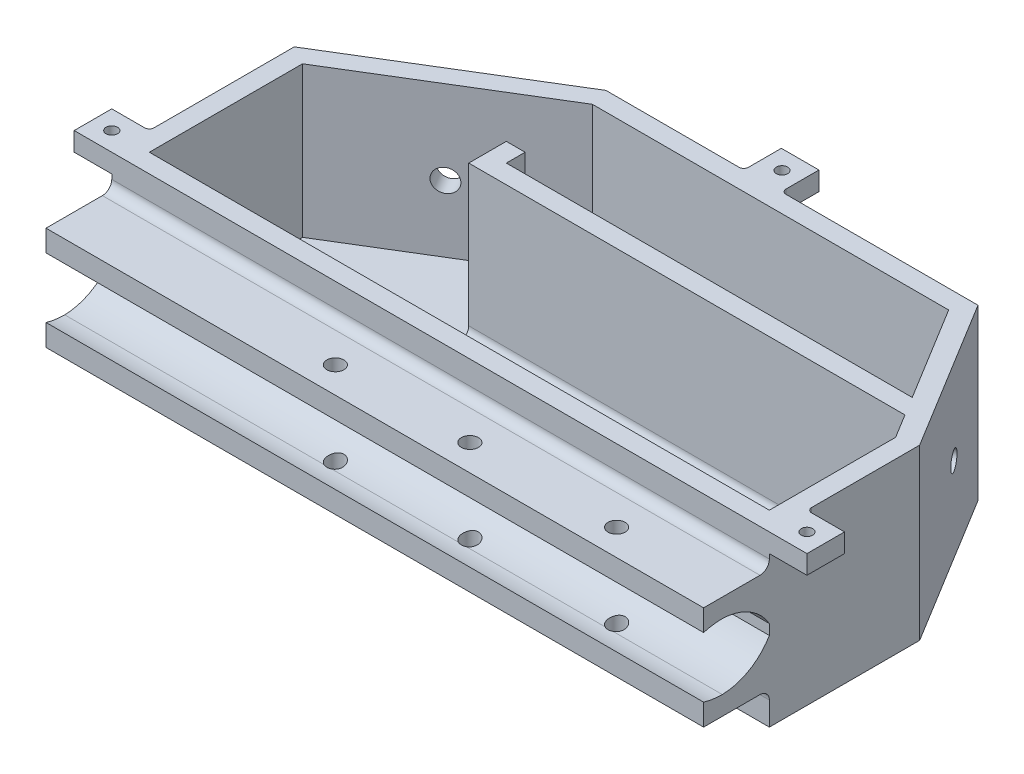
from build123d import *

# Parameters (mm, degrees)
SKETCH1_W            = 350
SKETCH1_H            = 160
SKETCH1_W_2          = 330
SKETCH1_H_2          = 140
BOSS_EXTRUDE1_DEPTH  = 80
SKETCH2_W            = 350
SKETCH2_H            = 160
BOSS_EXTRUDE2_DEPTH  = 10
SKETCH3_W            = 240
SKETCH3_H            = 10
BOSS_EXTRUDE3_DEPTH  = 80
SKETCH4_R            = 8.25
CUT_EXTRUDE1_DEPTH   = 10
SKETCH5_W            = 10
SKETCH5_H            = 80
BOSS_EXTRUDE4_DEPTH  = 10
SKETCH6_W            = 35
SKETCH6_H            = 55
BOSS_EXTRUDE5_DEPTH  = 350
CUT_EXTRUDE2_DEPTH   = 377.994694923
SKETCH8_R            = 4.55
CUT_EXTRUDE3_DEPTH   = 222.599300704
SKETCH9_W            = 20
SKETCH9_H            = 20
SKETCH9_R            = 3.05
BOSS_EXTRUDE7_DEPTH  = 10
FILLET1_R            = 5
CUT_EXTRUDE5_DEPTH   = 244.618554386
SKETCH13_W           = 120.654432285
SKETCH13_H           = 90
BOSS_EXTRUDE8_DEPTH  = 10
CUT_EXTRUDE8_DEPTH   = 244.618554386
SKETCH15_W           = 93.792566681
SKETCH15_H           = 90
BOSS_EXTRUDE9_DEPTH  = 10
SKETCH16_W           = 20
SKETCH16_H           = 20
SKETCH16_R           = 3.05
BOSS_EXTRUDE10_DEPTH = 10
SKETCH17_R           = 5
CUT_EXTRUDE9_DEPTH   = 10
SKETCH18_R           = 6
CUT_EXTRUDE10_DEPTH  = 10
FILLET2_R            = 2.5


with BuildPart() as part:
    # Sketch1 → Boss-Extrude1 (new body)
    with BuildSketch(Plane(origin=(0, 0, 0), x_dir=(1, 0, 0), z_dir=(0, 1, 0))):
        Rectangle(SKETCH1_W, SKETCH1_H)
        Rectangle(SKETCH1_W_2, SKETCH1_H_2, mode=Mode.SUBTRACT)
    extrude(amount=BOSS_EXTRUDE1_DEPTH)

    # Sketch2 → Boss-Extrude2 (add)
    with BuildSketch(Plane.XZ):
        Rectangle(SKETCH2_W, SKETCH2_H)
    extrude(amount=BOSS_EXTRUDE2_DEPTH)

    # Sketch3 → Boss-Extrude3 (add)
    with BuildSketch(Plane(origin=(0, 0, 0), x_dir=(1, 0, 0), z_dir=(0, 1, 0))):
        with Locations((45, 15)):
            Rectangle(SKETCH3_W, SKETCH3_H)
    extrude(amount=BOSS_EXTRUDE3_DEPTH)

    # Sketch4 → Cut-Extrude1 (cut)
    with BuildSketch(Plane.XZ.offset(10)):
        with Locations(Location((115, -45, 0), (0, 0, 270))):
            Circle(SKETCH4_R)
    extrude(amount=-CUT_EXTRUDE1_DEPTH, mode=Mode.SUBTRACT)

    # Sketch5 → Boss-Extrude4 (add)
    with BuildSketch(Plane(origin=(0, 0, -20), x_dir=(-1, 0, 0), z_dir=(0, 0, -1))):
        with Locations((70, 40)):
            Rectangle(SKETCH5_W, SKETCH5_H)
    extrude(amount=BOSS_EXTRUDE4_DEPTH)

    # Sketch6 → Boss-Extrude5 (add)
    with BuildSketch(Plane.ZY.offset(175)):
        with Locations((97.5, 35)):
            Rectangle(SKETCH6_W, SKETCH6_H)
    extrude(amount=-BOSS_EXTRUDE5_DEPTH)

    # Sketch7 → Cut-Extrude2 (cut, through all)
    with BuildSketch(Plane.ZY.offset(175)):
        with BuildLine():
            Line((80, 32.25), (80, 37.75))
            ThreePointArc((80, 37.75), (90.572772871, 48.370529591), (104.96357244, 52.551924426))
            add(Edge.make_bspline(
                [(105.036319557, 17.552000028), (130.036265556, 17.603962255), (129.999891997, 35.103924454), (129.963518438, 52.603886653), (104.96357244, 52.551924426)],
                knots=[1.570796327, 1.570796327, 1.570796327, 3.141592654, 3.141592654, 4.71238898, 4.71238898, 4.71238898], degree=2, weights=[1, 0.707106781, 1, 0.707106781, 1]))
            ThreePointArc((105.036319557, 17.552000028), (90.621814813, 21.670798719), (80, 32.25))
        make_face()
    extrude(amount=-CUT_EXTRUDE2_DEPTH, mode=Mode.SUBTRACT)

    # Sketch8 → Cut-Extrude3 (cut, through all)
    with BuildSketch(Plane(origin=(0, 62.5, 0), x_dir=(1, 0, 0), z_dir=(0, 1, 0))):
        with Locations(Location((-35, -101, 0), (0, 0, 242.51146341))):
            Circle(SKETCH8_R)
        with Locations(Location((36.6, -101, 0), (0, 0, 242.51146341))):
            Circle(SKETCH8_R)
        with Locations(Location((114.7, -101, 0), (0, 0, 242.51146341))):
            Circle(SKETCH8_R)
    extrude(amount=-CUT_EXTRUDE3_DEPTH, mode=Mode.SUBTRACT)

    # Sketch9 → Boss-Extrude7 (add)
    # profile 1 of 2: a face of its own
    with BuildSketch(Plane(origin=(0, 80, 0), x_dir=(1, 0, 0), z_dir=(0, 1, 0))):
        with Locations((185, -70)):
            Rectangle(SKETCH9_W, SKETCH9_H)
        with Locations(Location((185, -70, 0), (0, 0, 270))):
            Circle(SKETCH9_R, mode=Mode.SUBTRACT)
    # profile 2 of 2: a face of its own
    with BuildSketch(Plane(origin=(0, 80, 0), x_dir=(1, 0, 0), z_dir=(0, 1, 0))):
        with Locations((-185, -70)):
            Rectangle(SKETCH9_W, SKETCH9_H)
        with Locations(Location((-185, -70, 0), (0, 0, 90))):
            Circle(SKETCH9_R, mode=Mode.SUBTRACT)
    extrude(amount=-BOSS_EXTRUDE7_DEPTH)

    # Fillet1
    fillet1_edges = [part.edges().sort_by_distance(p)[0] for p in [
        (45, 0, -10),
        (50, 0, -20),
        (0, 7.5, 80),
        (0, 62.5, 80),
    ]]
    fillet(fillet1_edges, radius=FILLET1_R)

    # Sketch12 → Cut-Extrude5 (cut, through all)
    with BuildSketch(Plane(origin=(0, 80, 0), x_dir=(1, 0, 0), z_dir=(0, 1, 0))):
        Polygon((-72.01506271, 80), (-175, 17.138288908), (-175, 80), align=None)
    extrude(amount=-CUT_EXTRUDE5_DEPTH, mode=Mode.SUBTRACT)

    # Sketch13 → Boss-Extrude8 (add)
    with BuildSketch(Plane(origin=(-55.124817516, 0, -90.309757345), x_dir=(-0.8535528727753664, 0, 0.5210062316104475), z_dir=(-0.5210062316104475, 0, -0.8535528727753664))):
        with Locations((80.115381273, 35)):
            Rectangle(SKETCH13_W, SKETCH13_H)
    extrude(amount=-BOSS_EXTRUDE8_DEPTH)

    # Sketch14 → Cut-Extrude8 (cut, through all)
    with BuildSketch(Plane(origin=(0, 80, 0), x_dir=(1, 0, 0), z_dir=(0, 1, 0))):
        Polygon((126.04036801, 80), (175, 0), (175, 80), align=None)
    extrude(amount=-CUT_EXTRUDE8_DEPTH, mode=Mode.SUBTRACT)

    # Sketch15 → Boss-Extrude9 (add)
    with BuildSketch(Plane(origin=(127.315471061, 0, -77.916482622), x_dir=(-0.5219990637024984, 0, -0.8529460577866077), z_dir=(0.8529460577866077, 0, -0.5219990637024984))):
        with Locations((-44.453552808, 35)):
            Rectangle(SKETCH15_W, SKETCH15_H)
    extrude(amount=-BOSS_EXTRUDE9_DEPTH)

    # Sketch16 → Boss-Extrude10 (add)
    with BuildSketch(Plane(origin=(0, 80, 0), x_dir=(1, 0, 0), z_dir=(0, 1, 0))):
        with Locations((11.381009241, 90)):
            Rectangle(SKETCH16_W, SKETCH16_H)
        with Locations(Location((11.718047049, 90, 0), (0, 0, 270))):
            Circle(SKETCH16_R, mode=Mode.SUBTRACT)
    extrude(amount=-BOSS_EXTRUDE10_DEPTH)

    # Sketch17 → Cut-Extrude9 (cut)
    with BuildSketch(Plane(origin=(127.315471061, 0, -77.916482622), x_dir=(-0.5219990637024984, 0, -0.8529460577866076), z_dir=(0.8529460577866077, 0, -0.5219990637024985))):
        with Locations((-36.349836148, 35)):
            Circle(SKETCH17_R)
    extrude(amount=-CUT_EXTRUDE9_DEPTH, mode=Mode.SUBTRACT)

    # Sketch18 → Cut-Extrude10 (cut)
    with BuildSketch(Plane(origin=(-55.124817516, 0, -90.309757345), x_dir=(-0.8535528727753664, 0, 0.5210062316104476), z_dir=(-0.5210062316104476, 0, -0.8535528727753664))):
        with Locations((79.494288209, 35.423286216)):
            Circle(SKETCH18_R)
    extrude(amount=-CUT_EXTRUDE10_DEPTH, mode=Mode.SUBTRACT)

    # Fillet2
    fillet2_edges = [part.edges().sort_by_distance(p)[0] for p in [
        (175, 75, 60),
        (-175, 75, 60),
        (1.381009241, 75, -80),
        (21.381009241, 75, -80),
    ]]
    fillet(fillet2_edges, radius=FILLET2_R)


solid = part.part
